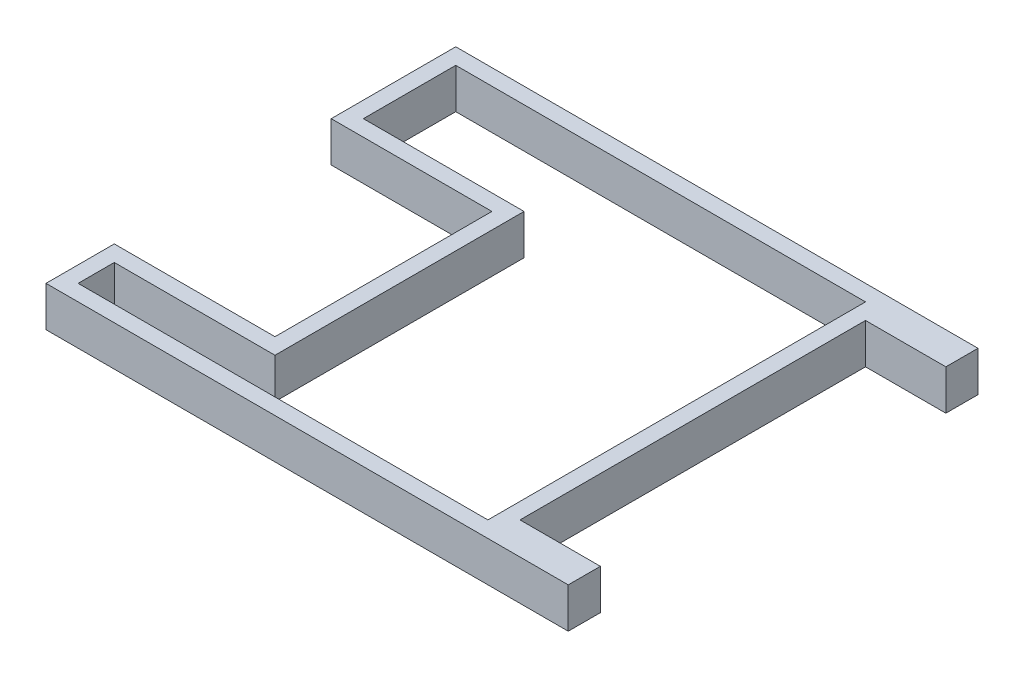
from build123d import *

# Parameters (mm, degrees)
EXTRUDE_4_DEPTH = 5


with BuildPart() as part:
    # 草图1 → 凸台-拉伸4 (new body)
    with BuildSketch(Plane(origin=(0, 0, 0), x_dir=(1, 0, 0), z_dir=(0, 1, 0))):
        Polygon((-44.775072214, 5.646396396), (-24.775072214, 5.646396396), (-24.775072214, -21.353603604), (-44.775072214, -21.353603604), (-44.775072214, -29.853603604), (20.224927786, -29.853603604), (20.224927786, -25.853603604), (10.224927786, -25.853603604), (10.224927786, 17.146396396), (20.224927786, 17.146396396), (20.224927786, 21.146396396), (-44.775072214, 21.146396396), align=None)
        Polygon((-42.775072214, 19.146396396), (8.224927786, 19.146396396), (8.224927786, -27.853603604), (-42.775072214, -27.853603604), (-42.775072214, -23.353603604), (-22.775072214, -23.353603604), (-22.775072214, 7.646396396), (-42.775072214, 7.646396396), align=None, mode=Mode.SUBTRACT)
    extrude(amount=EXTRUDE_4_DEPTH)


solid = part.part
